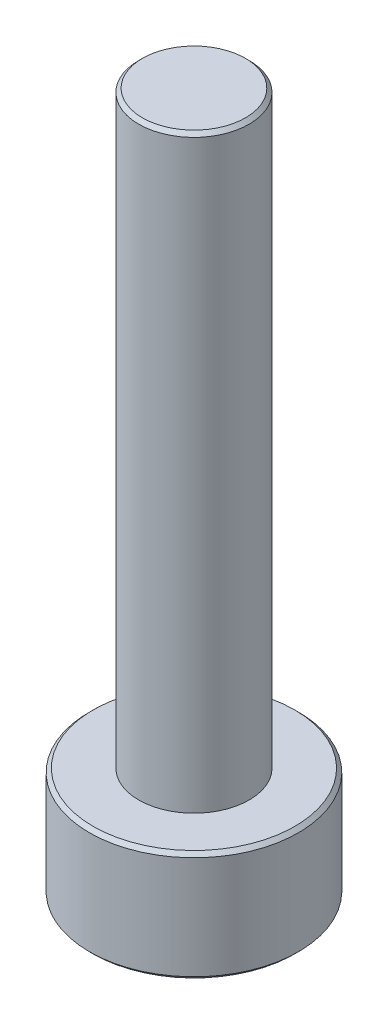
from build123d import *

# Parameters (mm, degrees)
SKETCH_1_R            = 2.84
EXTRUDE_261_DEPTH     = 3
SKETCH_2_R            = 1.5
EXTRUDE_346_DEPTH     = 16
CUT_EXTRUDE_530_DEPTH = 1.3
CHAMFER_592_SIZE      = 0.1


with BuildPart() as part:
    # 草图1 → Extrude 261 (new body)
    with BuildSketch(Plane(origin=(0, 0, 0), x_dir=(1, 0, 0), z_dir=(0, 1, 0))):
        with Locations(Location((0, 0, 0), (0, 0, 270))):
            Circle(SKETCH_1_R)
    extrude(amount=EXTRUDE_261_DEPTH)

    # 草图2 → Extrude 346 (add)
    with BuildSketch(Plane(origin=(0, 3, 0), x_dir=(1, 0, 0), z_dir=(0, 1, 0))):
        with Locations(Location((0, 0, 0), (0, 0, 270))):
            Circle(SKETCH_2_R)
    extrude(amount=EXTRUDE_346_DEPTH)

    # 草图3 → Cut-Extrude 530 (cut)
    with BuildSketch(Plane.XZ):
        Polygon((1.29, -0.744781847), (1.29, 0.744781847), (0, 1.489563695), (-1.29, 0.744781847), (-1.29, -0.744781847), (0, -1.489563695), align=None)
    extrude(amount=-CUT_EXTRUDE_530_DEPTH, mode=Mode.SUBTRACT)

    # Chamfer 592
    chamfer_592_edges = [part.edges().sort_by_distance(p)[0] for p in [
        (0, 0, -2.84),
        (0, 3, -2.84),
        (0, 19, -1.5),
    ]]
    chamfer(chamfer_592_edges, length=CHAMFER_592_SIZE)


solid = part.part
